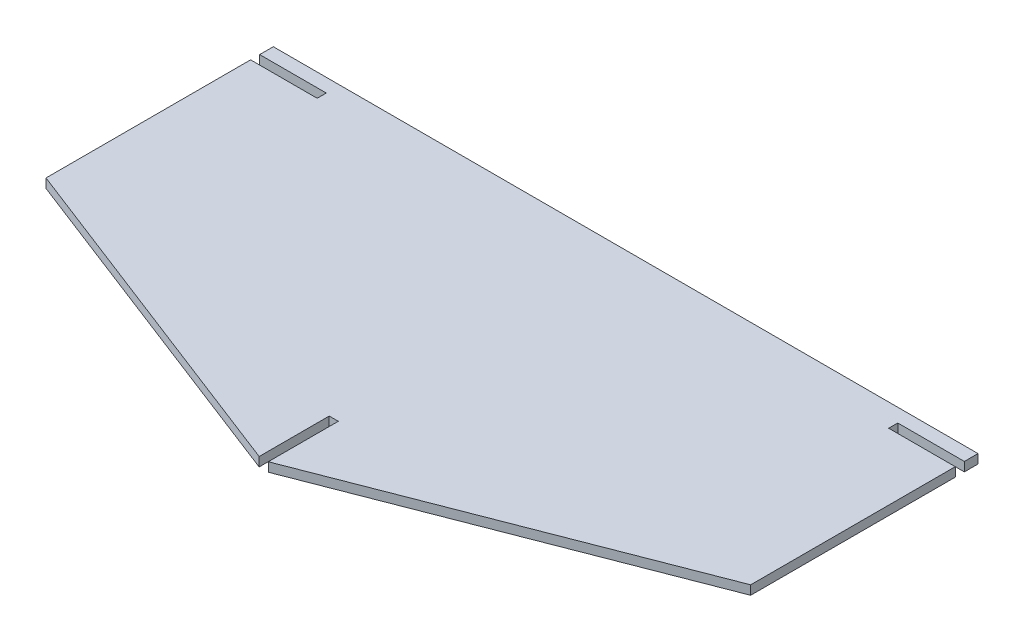
from build123d import *

# Parameters (mm, degrees)
BOSS_EXTRUDE1_DEPTH = 4


with BuildPart() as part:
    # Sketch1 → Boss-Extrude1 (new body)
    with BuildSketch(Plane(origin=(0, 0, 0), x_dir=(1, 0, 0), z_dir=(0, 1, 0))):
        Polygon((310, -100), (310, -10), (280.7, -10), (280.7, -6), (310, -6), (310, 0), (0, 0), (0, -6), (29.3, -6), (29.3, -10), (0, -10), (0, -100), (153, -159.225806452), (153, -128.4), (157, -128.4), (157, -159.225806452), align=None)
    extrude(amount=BOSS_EXTRUDE1_DEPTH)


solid = part.part
